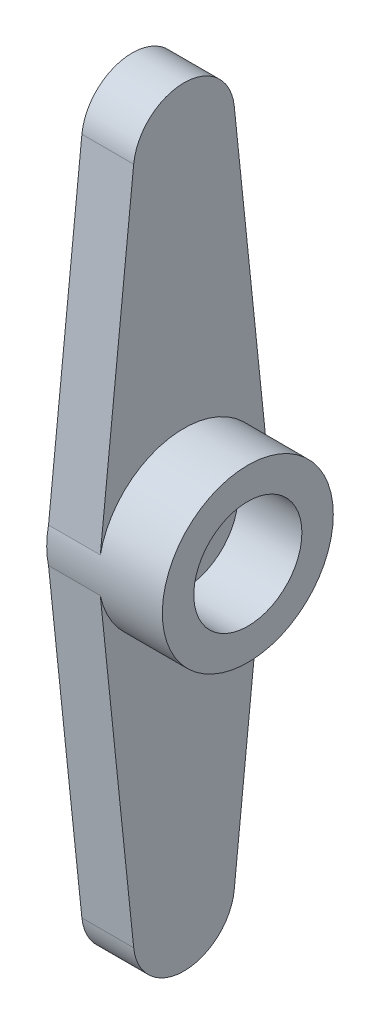
from build123d import *

# Parameters (mm, degrees)
SKETCH1_R           = 4.318
BOSS_EXTRUDE1_DEPTH = 5.842
BOSS_EXTRUDE2_DEPTH = 2.6162
SKETCH3_R           = 2.7305
CUT_EXTRUDE1_DEPTH  = 3.2258


with BuildPart() as part:
    # Sketch1 → Boss-Extrude1 (new body)
    with BuildSketch(Plane(origin=(0, 0, 0), x_dir=(0, 0, -1), z_dir=(1, 0, 0))):
        Circle(SKETCH1_R)
    extrude(amount=BOSS_EXTRUDE1_DEPTH)

    # Sketch2 → Boss-Extrude2 (add)
    with BuildSketch(Plane.ZY):
        with BuildLine():
            Line((-2.54, 17.140843061), (-4.226068598, 0.886266441))
            ThreePointArc((-4.226068598, 0.886266441), (0, 4.318), (4.226068598, 0.886266441))
            Line((4.226068598, 0.886266441), (2.54, 17.140843061))
            ThreePointArc((2.54, 17.140843061), (0, 19.431), (-2.54, 17.140843061))
        make_face()
    boss_extrude2 = extrude(amount=-BOSS_EXTRUDE2_DEPTH)

    # Mirror1: Boss-Extrude2 across plane
    add(boss_extrude2.mirror(Plane.ZX))

    # Sketch3 → Cut-Extrude1 (cut)
    with BuildSketch(Plane(origin=(5.842, 0, 0), x_dir=(0, 0, -1), z_dir=(1, 0, 0))):
        Circle(SKETCH3_R)
    extrude(amount=-CUT_EXTRUDE1_DEPTH, mode=Mode.SUBTRACT)


solid = part.part
